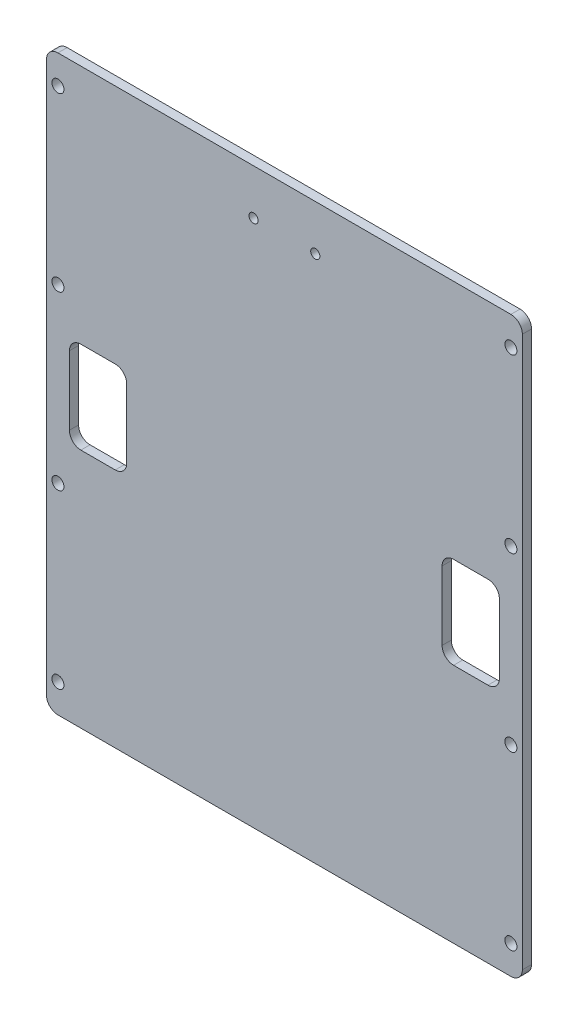
from build123d import *

# Parameters (mm, degrees)
BOARDOUTLINE_DEPTH   = 1.6
SKETCH2_R            = 0.8
COMPONENTHOLES_DEPTH = 65.998538445
WINDOWS_1SIDE_DEPTH  = 65.998538445
M2_CLEARANCE_HOLE1_D = 2.1


with BuildPart() as part:
    # Sketch1 → boardOutline (new body)
    with BuildSketch(Plane.XY):
        with BuildLine():
            Line((-39.5, -50), (39.5, -50))
            ThreePointArc((39.5, -50), (40.914213562, -49.414213562), (41.5, -48))
            Line((41.5, -48), (41.5, 48))
            ThreePointArc((41.5, 48), (40.914213562, 49.414213562), (39.5, 50))
            Line((39.5, 50), (-39.5, 50))
            ThreePointArc((-39.5, 50), (-40.914213562, 49.414213562), (-41.5, 48))
            Line((-41.5, 48), (-41.5, -48))
            ThreePointArc((-41.5, -48), (-40.914213562, -49.414213562), (-39.5, -50))
        make_face()
    extrude(amount=BOARDOUTLINE_DEPTH)

    # Sketch2 → componentHoles (cut, through all)
    with BuildSketch(Plane.XY.offset(1.6)):
        with Locations((-5.385, 42.1)):
            Circle(SKETCH2_R)
        with Locations((5.385, 42.1)):
            Circle(SKETCH2_R)
    extrude(amount=-COMPONENTHOLES_DEPTH, mode=Mode.SUBTRACT)

    # Sketch3 → windows_1side (cut, through all)
    with BuildSketch(Plane.XY.offset(1.6)):
        with BuildLine():
            Line((37.5, -6), (37.5, 6))
            ThreePointArc((37.5, 6), (36.914213562, 7.414213562), (35.5, 8))
            Line((35.5, 8), (29.5, 8))
            ThreePointArc((29.5, 8), (28.085786438, 7.414213562), (27.5, 6))
            Line((27.5, 6), (27.5, -6))
            ThreePointArc((27.5, -6), (28.085786438, -7.414213562), (29.5, -8))
            Line((29.5, -8), (35.5, -8))
            ThreePointArc((35.5, -8), (36.914213562, -7.414213562), (37.5, -6))
        make_face()
        with BuildLine():
            Line((-29.5, -8), (-35.5, -8))
            ThreePointArc((-35.5, -8), (-36.914213562, -7.414213562), (-37.5, -6))
            Line((-37.5, -6), (-37.5, 6))
            ThreePointArc((-37.5, 6), (-36.914213562, 7.414213562), (-35.5, 8))
            Line((-35.5, 8), (-29.5, 8))
            ThreePointArc((-29.5, 8), (-28.085786438, 7.414213562), (-27.5, 6))
            Line((-27.5, 6), (-27.5, -6))
            ThreePointArc((-27.5, -6), (-28.085786438, -7.414213562), (-29.5, -8))
        make_face()
    extrude(amount=-WINDOWS_1SIDE_DEPTH, mode=Mode.SUBTRACT)

    # M2 Clearance Hole1 (through all)
    with Locations(Plane(origin=(0, 0, 0), x_dir=(-1, 0, 0), z_dir=(0, 0, -1))):
        with Locations((39.5, 45), (39.5, -15), (39.5, -45), (39.5, 15)):
            m2_clearance_hole1 = Hole(M2_CLEARANCE_HOLE1_D / 2)

    # Mirror1: M2 Clearance Hole1 across plane
    add(m2_clearance_hole1.mirror(Plane(origin=(0, 0, 0), x_dir=(0, 0, 1), z_dir=(1, 0, 0))), mode=Mode.SUBTRACT)


solid = part.part
